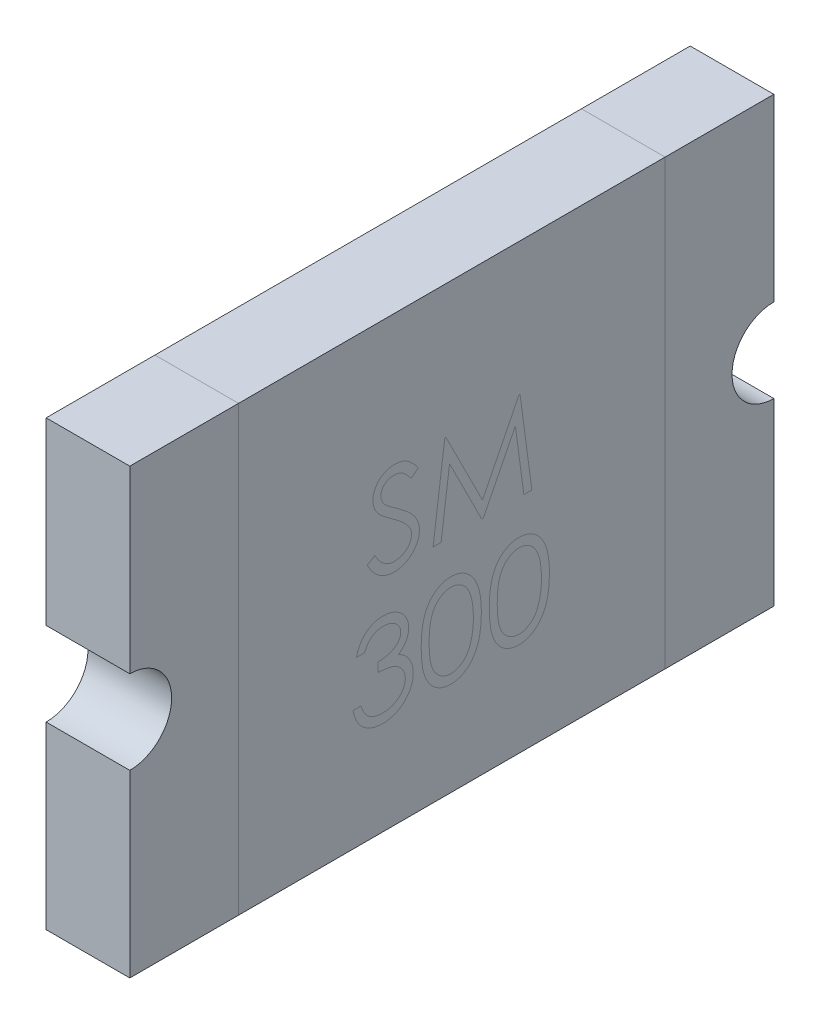
from build123d import *

# Parameters (mm, degrees)
SKETCH_1_W          = 7.7
SKETCH_1_H          = 5.3
EXTRUDE_1_DEPTH     = 1
CUT_EXTRUDE_1_DEPTH = 1


with BuildPart() as part:
    # 草图1 → 凸台-拉伸1 (new body)
    with BuildSketch(Plane(origin=(0, 0, 0), x_dir=(0, 0, -1), z_dir=(1, 0, 0))):
        Rectangle(SKETCH_1_W, SKETCH_1_H)
    extrude(amount=EXTRUDE_1_DEPTH)

    # 草图2 → 切除-拉伸1 (cut)
    with BuildSketch(Plane(origin=(1, 0, 0), x_dir=(0, 0, -1), z_dir=(1, 0, 0))):
        with BuildLine():
            Line((-3.85, -0.5), (-3.85, 0.5))
            ThreePointArc((-3.85, 0.5), (-3.35, 0), (-3.85, -0.5))
        make_face()
        with BuildLine():
            Line((3.85, -0.5), (3.85, 0.5))
            ThreePointArc((3.85, 0.5), (3.35, 0), (3.85, -0.5))
        make_face()
    extrude(amount=-CUT_EXTRUDE_1_DEPTH, mode=Mode.SUBTRACT)


solid = part.part
